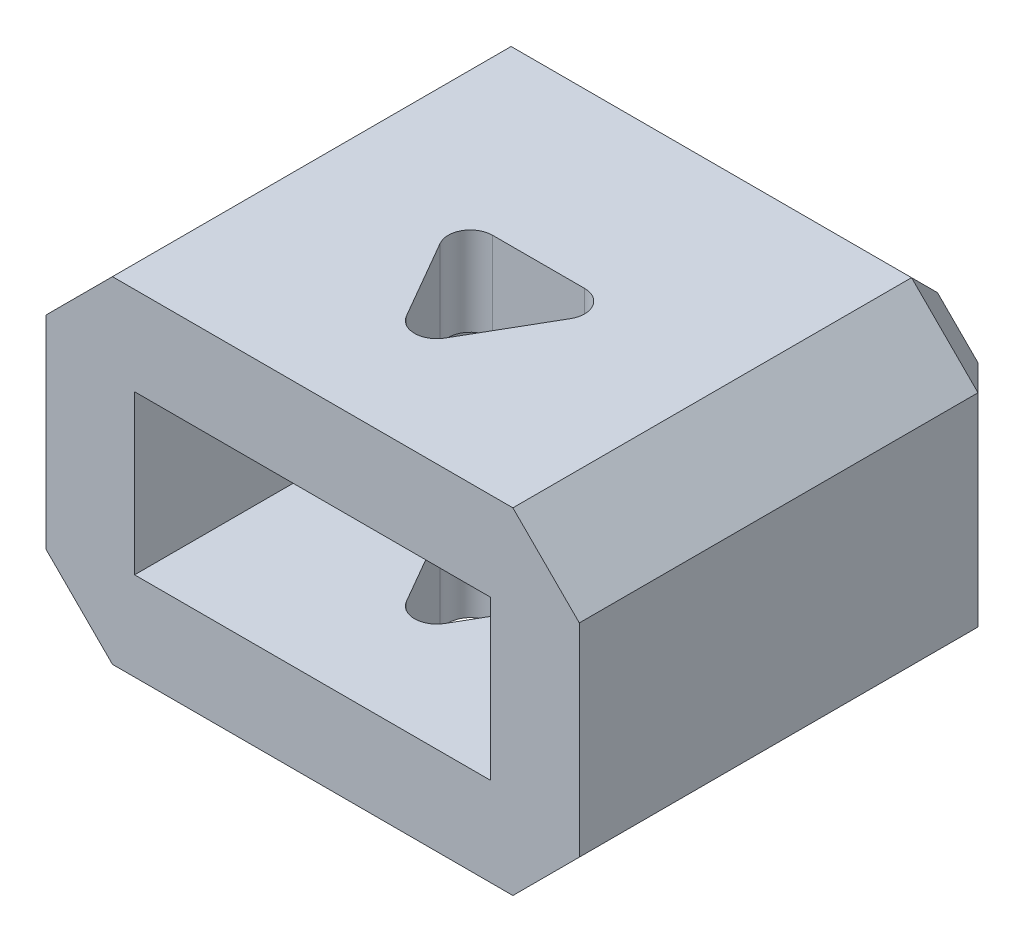
from build123d import *

# Parameters (mm, degrees)
SKETCH1_W               = 12.04
SKETCH1_H               = 7.58
SKETCH1_W_2             = 8.04
SKETCH1_H_2             = 3.58
BOSS_EXTRUDE1_DEPTH     = 8
SKETCH1_2_W             = 12.04
SKETCH1_2_H             = 7.58
BOSS_EXTRUDE2_DEPTH     = 2
CHAMFER1_SIZE           = 1.5
CUT_EXTRUDE1_DEPTH      = 13.55773865
CUT_EXTRUDE1_DEPTH_BACK = 13.55773865
FILLET1_R               = 0.5
CHAMFER2_SIZE           = 1


with BuildPart() as part:
    # Sketch1 → Boss-Extrude1 (new body)
    with BuildSketch(Plane.XY):
        Rectangle(SKETCH1_W, SKETCH1_H)
        Rectangle(SKETCH1_W_2, SKETCH1_H_2, mode=Mode.SUBTRACT)
    extrude(amount=BOSS_EXTRUDE1_DEPTH)

    # Sketch1<2> → Boss-Extrude2 (add)
    with BuildSketch(Plane.XY):
        Rectangle(SKETCH1_2_W, SKETCH1_2_H)
    extrude(amount=-BOSS_EXTRUDE2_DEPTH)

    # Chamfer1
    chamfer1_edges = [part.edges().sort_by_distance(p)[0] for p in [
        (-6.02, -3.79, 3),
        (-6.02, 3.79, 3),
        (6.02, 3.79, 3),
        (6.02, -3.79, 3),
    ]]
    chamfer(chamfer1_edges, length=CHAMFER1_SIZE)

    # Sketch2 → Cut-Extrude1 (cut, two sides: drawn at the far end of the back side and taken through both)
    with BuildSketch(Plane.XZ.offset(3.79).offset(-CUT_EXTRUDE1_DEPTH_BACK)):
        Polygon((-1.905255888, 2.9), (1.905255888, 2.9), (0, 6.2), align=None)
    extrude(amount=CUT_EXTRUDE1_DEPTH + CUT_EXTRUDE1_DEPTH_BACK, mode=Mode.SUBTRACT)

    # Fillet1
    fillet1_edges = [part.edges().sort_by_distance(p)[0] for p in [
        (-1.905255888, 2.79, 2.9),
        (0, 2.79, 6.2),
        (1.905255888, 2.79, 2.9),
        (1.905255888, -2.79, 2.9),
        (0, -2.79, 6.2),
        (-1.905255888, -2.79, 2.9),
    ]]
    fillet(fillet1_edges, radius=FILLET1_R)

    # Chamfer2
    chamfer2_edges = [part.edges().sort_by_distance(p)[0] for p in [
        (5.27, -3.04, -2),
        (6.02, 0, -2),
        (5.27, 3.04, -2),
        (0, 3.79, -2),
        (-5.27, 3.04, -2),
        (-6.02, 0, -2),
        (-5.27, -3.04, -2),
        (0, -3.79, -2),
    ]]
    chamfer(chamfer2_edges, length=CHAMFER2_SIZE)


solid = part.part
